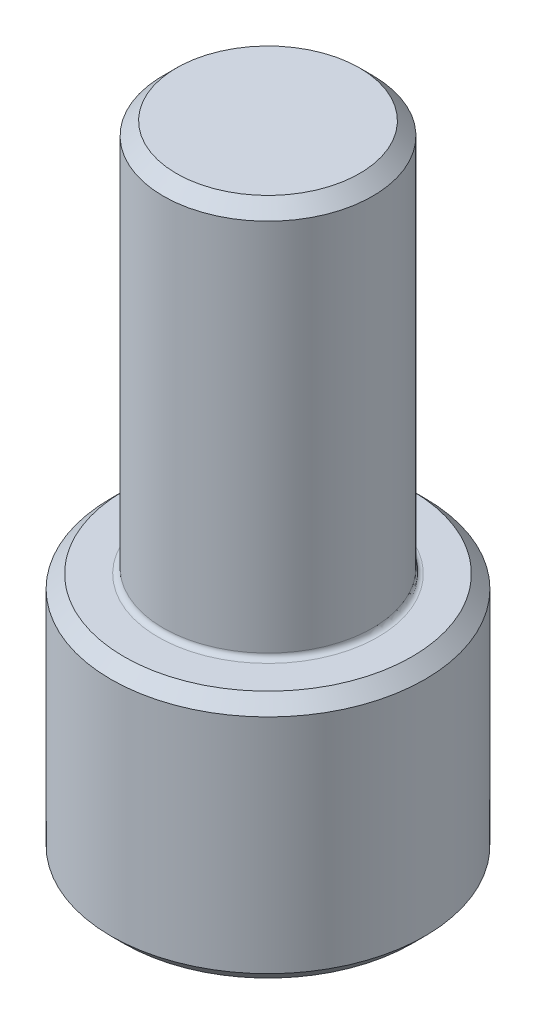
from build123d import *

# Parameters (mm, degrees)
M4_TAPPED_HOLE1_D     = 3.3
M4_TAPPED_HOLE1_DEPTH = 10.1
M4_TAPPED_HOLE1_TIP   = 0.991420021
FILLET1_R             = 0.2
CHAMFER1_SIZE         = 0.5


with BuildPart() as part:
    # Sketch1 → Revolve1 (revolve)
    with BuildSketch(Plane.XY, mode=Mode.PRIVATE) as revolve1_sk:
        Polygon((0, 0), (6, 0), (6, 9.5), (4, 9.5), (4, 24.5), (0, 24.5), align=None)
    revolve(revolve1_sk.sketch.rotate(Axis((0, 7.476190476, 0), (0, -1, 0)), 90), axis=Axis((0, 7.476190476, 0), (0, -1, 0)))

    # M4 Tapped Hole1
    with Locations(Plane(origin=(0, 0, 0), x_dir=(-1, 0, 0), z_dir=(0, -1, 0))):
        with Locations((0, 0)):
            Hole(M4_TAPPED_HOLE1_D / 2, depth=M4_TAPPED_HOLE1_DEPTH)
            with Locations((0, 0, -(M4_TAPPED_HOLE1_DEPTH + M4_TAPPED_HOLE1_TIP / 2))):  # 118° drill point
                Cone(0, M4_TAPPED_HOLE1_D / 2, M4_TAPPED_HOLE1_TIP, mode=Mode.SUBTRACT)

    # Fillet1
    fillet1_edges = [part.edges().sort_by_distance(p)[0] for p in [
        (0, 9.5, -4),
    ]]
    fillet(fillet1_edges, radius=FILLET1_R)

    # Chamfer1
    chamfer1_edges = [part.edges().sort_by_distance(p)[0] for p in [
        (0, 24.5, -4),
        (0, 9.5, -6),
        (0, 0, -6),
    ]]
    chamfer(chamfer1_edges, length=CHAMFER1_SIZE)


solid = part.part
